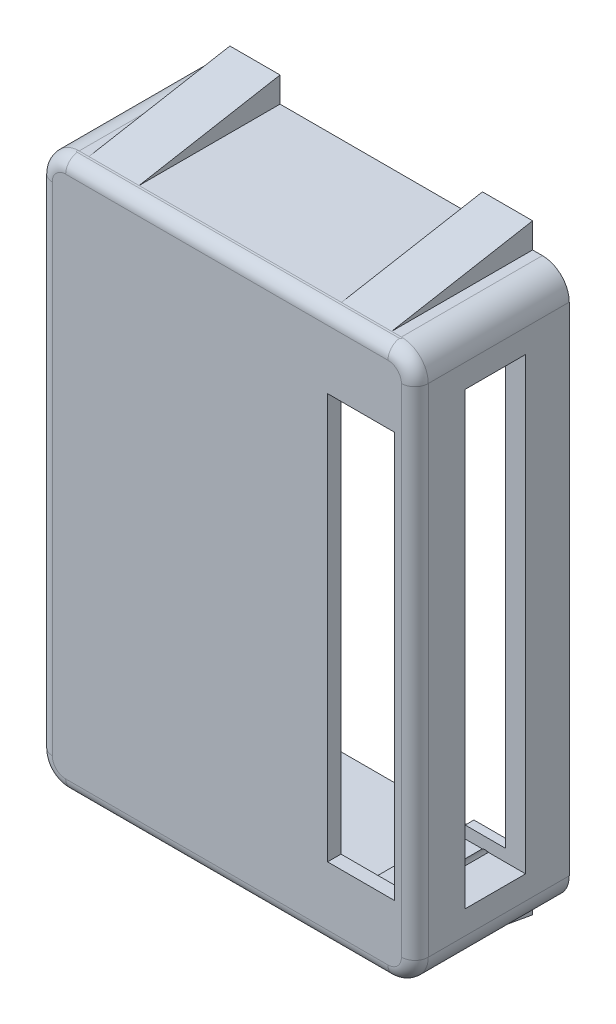
from build123d import *

# Parameters (mm, degrees)
CROQUIS1_W                   = 56
CROQUIS1_H                   = 82
CROQUIS1_W_2                 = 50
CROQUIS1_H_2                 = 76
EXTRUIR_L_MINA1_DEPTH        = 22
REDONDEO1_R                  = 4
REDONDEO2_R                  = 4
REDONDEO3_R                  = 4
REDONDEO4_R                  = 4
SALIENTE_EXTRUIR1_DEPTH      = 1
SALIENTE_EXTRUIR1_DEPTH_BACK = 1
REDONDEO5_R                  = 2
CROQUIS3_W                   = 6
CROQUIS3_H                   = 6.3
SALIENTE_EXTRUIR2_DEPTH      = 15.8
CROQUIS4_R                   = 0.75
CORTAR_EXTRUIR1_DEPTH        = 10
CROQUIS5_W                   = 10
CROQUIS5_H                   = 60.4
CORTAR_EXTRUIR2_DEPTH        = 10
CROQUIS6_W                   = 9
CROQUIS6_H                   = 67
CORTAR_EXTRUIR4_DEPTH        = 10
CROQUIS7_W                   = 3.2
CROQUIS7_H                   = 17
CORTAR_EXTRUIR5_DEPTH        = 10
CROQUIS8_W                   = 7.469429576
CROQUIS8_H                   = 3.762632311
SALIENTE_EXTRUIR3_DEPTH      = 22
CORTAR_EXTRUIR6_DEPTH        = 85
CROQUIS10_R                  = 1.25
CORTAR_EXTRUIR7_DEPTH        = 10
CROQUIS11_R                  = 1.1
CORTAR_EXTRUIR8_DEPTH        = 10


with BuildPart() as part:
    # Croquis1 → Extruir-Lámina1 (new body)
    with BuildSketch(Plane.XY):
        Rectangle(CROQUIS1_W, CROQUIS1_H)
        Rectangle(CROQUIS1_W_2, CROQUIS1_H_2, mode=Mode.SUBTRACT)
    extrude(amount=EXTRUIR_L_MINA1_DEPTH)

    # Redondeo1
    redondeo1_edges = [part.edges().sort_by_distance(p)[0] for p in [
        (-28, 41, 11),
    ]]
    fillet(redondeo1_edges, radius=REDONDEO1_R)

    # Redondeo2
    redondeo2_edges = [part.edges().sort_by_distance(p)[0] for p in [
        (28, 41, 11),
    ]]
    fillet(redondeo2_edges, radius=REDONDEO2_R)

    # Redondeo3
    redondeo3_edges = [part.edges().sort_by_distance(p)[0] for p in [
        (28, -41, 11),
    ]]
    fillet(redondeo3_edges, radius=REDONDEO3_R)

    # Redondeo4
    redondeo4_edges = [part.edges().sort_by_distance(p)[0] for p in [
        (-28, -41, 11),
    ]]
    fillet(redondeo4_edges, radius=REDONDEO4_R)

    # Croquis2 → Saliente-Extruir1 (add, two sides: drawn at the far end of the back side and taken through both)
    with BuildSketch(Plane.XY.offset(22).offset(-SALIENTE_EXTRUIR1_DEPTH_BACK)):
        with BuildLine():
            Line((-28, 37), (-28, -37))
            ThreePointArc((-28, -37), (-26.828427125, -39.828427125), (-24, -41))
            Line((-24, -41), (24, -41))
            ThreePointArc((24, -41), (26.828427125, -39.828427125), (28, -37))
            Line((28, -37), (28, 37))
            ThreePointArc((28, 37), (26.828427125, 39.828427125), (24, 41))
            Line((24, 41), (-24, 41))
            ThreePointArc((-24, 41), (-26.828427125, 39.828427125), (-28, 37))
        make_face()
    extrude(amount=SALIENTE_EXTRUIR1_DEPTH + SALIENTE_EXTRUIR1_DEPTH_BACK)

    # Redondeo5
    redondeo5_edges = [part.edges().sort_by_distance(p)[0] for p in [
        (-26.828427125, 39.828427125, 23),
        (-28, 0, 23),
        (-26.828427125, -39.828427125, 23),
        (0, -41, 23),
        (26.828427125, -39.828427125, 23),
        (28, 0, 23),
        (26.828427125, 39.828427125, 23),
        (0, 41, 23),
    ]]
    fillet(redondeo5_edges, radius=REDONDEO5_R)

    # Croquis3 → Saliente-Extruir2 (add)
    with BuildSketch(Plane(origin=(0, 0, 21), x_dir=(-1, 0, 0), z_dir=(0, 0, -1))):
        with Locations((-22, 34.85)):
            Rectangle(CROQUIS3_W, CROQUIS3_H)
        with Locations((-22, -34.85)):
            Rectangle(CROQUIS3_W, CROQUIS3_H)
        with Locations((22, 34.85)):
            Rectangle(CROQUIS3_W, CROQUIS3_H)
        with Locations((22, -34.85)):
            Rectangle(CROQUIS3_W, CROQUIS3_H)
    extrude(amount=SALIENTE_EXTRUIR2_DEPTH)

    # Croquis4 → Cortar-Extruir1 (cut)
    with BuildSketch(Plane(origin=(0, 0, 5.2), x_dir=(-1, 0, 0), z_dir=(0, 0, -1))):
        with Locations((-22, 34.5)):
            Circle(CROQUIS4_R)
        with Locations((22, 34.5)):
            Circle(CROQUIS4_R)
        with Locations((22, -34.5)):
            Circle(CROQUIS4_R)
        with Locations((-22, -34.5)):
            Circle(CROQUIS4_R)
    extrude(amount=-CORTAR_EXTRUIR1_DEPTH, mode=Mode.SUBTRACT)

    # Croquis5 → Cortar-Extruir2 (cut)
    with BuildSketch(Plane(origin=(0, 0, 21), x_dir=(-1, 0, 0), z_dir=(0, 0, -1))):
        with Locations((-20, 0)):
            Rectangle(CROQUIS5_W, CROQUIS5_H)
    extrude(amount=-CORTAR_EXTRUIR2_DEPTH, mode=Mode.SUBTRACT)

    # Croquis6 → Cortar-Extruir4 (cut)
    with BuildSketch(Plane(origin=(28, 0, 0), x_dir=(0, 0, -1), z_dir=(1, 0, 0))):
        with Locations((-11, 0)):
            Rectangle(CROQUIS6_W, CROQUIS6_H)
    extrude(amount=-CORTAR_EXTRUIR4_DEPTH, mode=Mode.SUBTRACT)

    # Croquis7 → Cortar-Extruir5 (cut)
    with BuildSketch(Plane(origin=(0, 0, 0), x_dir=(-1, 0, 0), z_dir=(0, 0, -1))):
        with Locations((25.4, -14.5)):
            Rectangle(CROQUIS7_W, CROQUIS7_H)
    extrude(amount=-CORTAR_EXTRUIR5_DEPTH, mode=Mode.SUBTRACT)

    # Croquis8 → Saliente-Extruir3 (add)
    with BuildSketch(Plane(origin=(0, 0, 0), x_dir=(-1, 0, 0), z_dir=(0, 0, -1))):
        with Locations((18.80938175, 42.881316156)):
            Rectangle(CROQUIS8_W, CROQUIS8_H)
        with Locations((-18.80938175, 42.881316156)):
            Rectangle(CROQUIS8_W, CROQUIS8_H)
        with Locations((-18.80938175, -42.881316156)):
            Rectangle(CROQUIS8_W, CROQUIS8_H)
        with Locations((18.80938175, -42.881316156)):
            Rectangle(CROQUIS8_W, CROQUIS8_H)
    extrude(amount=-SALIENTE_EXTRUIR3_DEPTH)

    # Croquis9 → Cortar-Extruir6 (cut)
    with BuildSketch(Plane(origin=(28, 0, 0), x_dir=(0, 0, -1), z_dir=(1, 0, 0))):
        Polygon((-21, 41), (0, 44.762632311), (0.10305202, 48.489025058), (-25.204298305, 46.436230698), (-22.314872849, 40.902663886), align=None)
        Polygon((-22.314872849, -40.902663886), (-21, -41), (0, -44.762632311), (0.10305202, -48.489025058), (-25.204298305, -46.436230698), align=None)
    extrude(amount=-CORTAR_EXTRUIR6_DEPTH, mode=Mode.SUBTRACT)

    # Croquis10 → Cortar-Extruir7 (cut)
    with BuildSketch(Plane(origin=(0, 0, 0), x_dir=(-1, 0, 0), z_dir=(0, 0, -1))):
        with Locations((-19, 41.25)):
            Circle(CROQUIS10_R)
        with Locations((19, 41.25)):
            Circle(CROQUIS10_R)
        with Locations((-19, -41.25)):
            Circle(CROQUIS10_R)
        with Locations((19, -41.25)):
            Circle(CROQUIS10_R)
    extrude(amount=-CORTAR_EXTRUIR7_DEPTH, mode=Mode.SUBTRACT)

    # Croquis11 → Cortar-Extruir8 (cut)
    with BuildSketch(Plane(origin=(0, 0, 5.2), x_dir=(-1, 0, 0), z_dir=(0, 0, -1))):
        with Locations((-22, 34.5)):
            Circle(CROQUIS11_R)
        with Locations((22, 34.5)):
            Circle(CROQUIS11_R)
        with Locations((22, -34.5)):
            Circle(CROQUIS11_R)
        with Locations((-22, -34.5)):
            Circle(CROQUIS11_R)
    extrude(amount=-CORTAR_EXTRUIR8_DEPTH, mode=Mode.SUBTRACT)


solid = part.part
